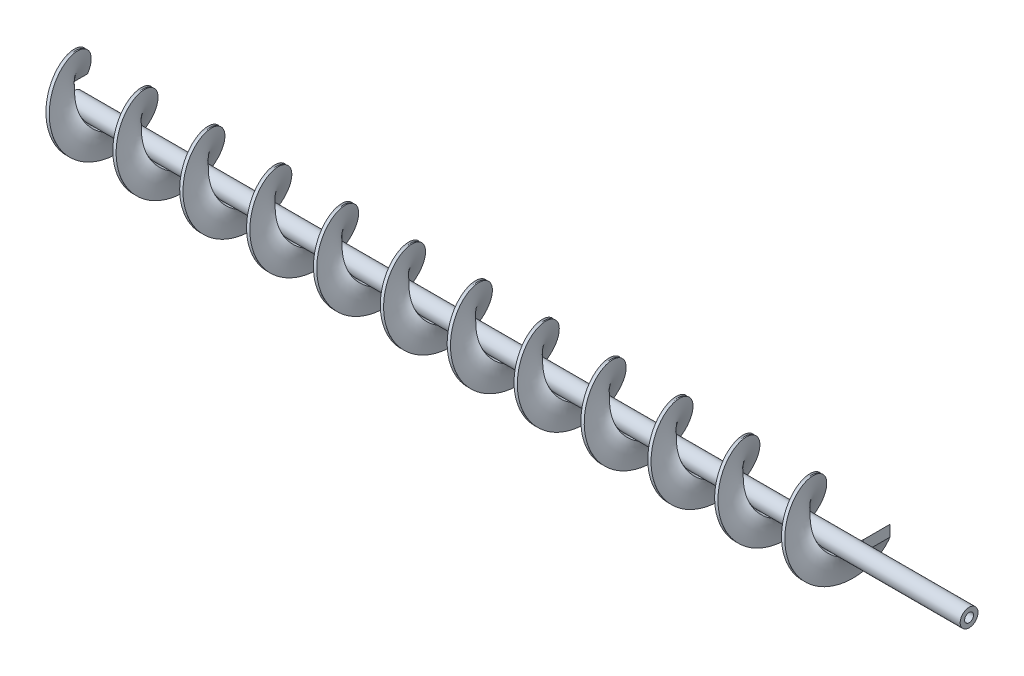
from build123d import *

# Parameters (mm, degrees)
AUFSATZ_LINEAR_AUSTRAGEN1_DEPTH      = 51.5
AUFSATZ_LINEAR_AUSTRAGEN1_DEPTH_BACK = 350
SKIZZE3_R                            = 4
SKIZZE3_R_2                          = 2
AUSTRAGUNG1_PITCH                    = 30
AUSTRAGUNG1_HEIGHT                   = 360
AUSTRAGUNG1_RADIUS                   = 4
SKIZZE2_W                            = 12
SKIZZE2_H                            = 5


with BuildPart() as part:
    # Skizze3 → Aufsatz-Linear austragen1 (new, two sides: drawn at the far end of the back side and taken through both)
    with BuildSketch(Plane(origin=(0, 0, 0), x_dir=(0, 0, -1), z_dir=(1, 0, 0)).offset(-AUFSATZ_LINEAR_AUSTRAGEN1_DEPTH_BACK)):
        Circle(SKIZZE3_R)
        Circle(SKIZZE3_R_2, mode=Mode.SUBTRACT)
    extrude(amount=AUFSATZ_LINEAR_AUSTRAGEN1_DEPTH + AUFSATZ_LINEAR_AUSTRAGEN1_DEPTH_BACK)


with BuildPart() as body_2:
    # Austragung1: sweep along a helix
    with BuildLine() as austragung1_path:
        Helix(AUSTRAGUNG1_PITCH, AUSTRAGUNG1_HEIGHT, AUSTRAGUNG1_RADIUS, center=(0, 0, 0), direction=(-1, 0, 0))
    # Skizze2 → Austragung1 (sweep)
    with BuildSketch(Plane(origin=(0, 0, 0), x_dir=(0, 0, -1), z_dir=(1, 0, 0))):
        with Locations((10, 0)):
            Rectangle(SKIZZE2_W, SKIZZE2_H)
    sweep(path=austragung1_path.line, is_frenet=True)


solid = Compound([part.part, body_2.part])
